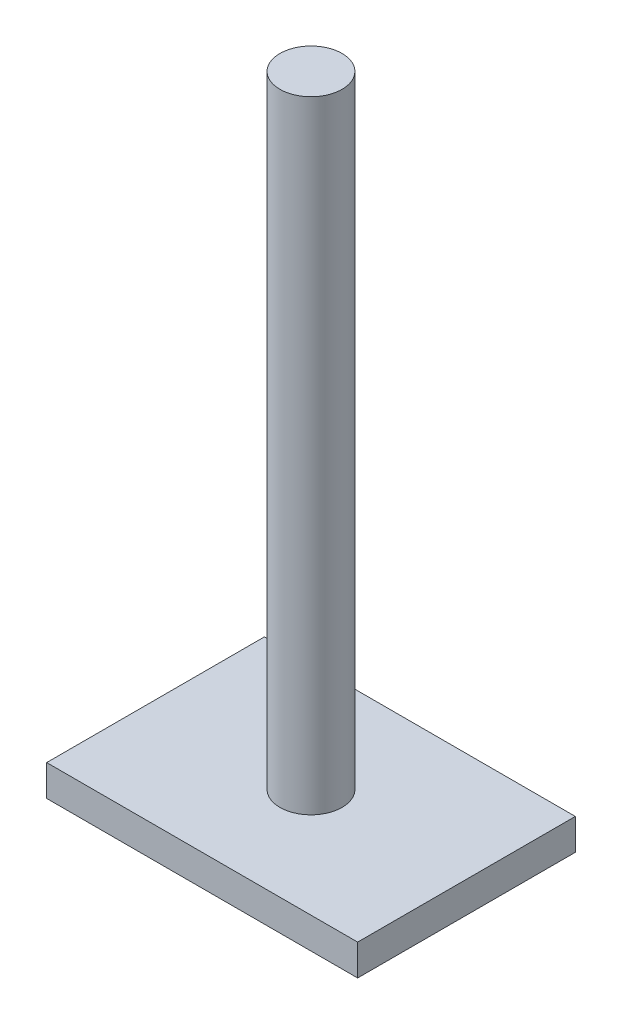
from build123d import *

# Parameters (mm, degrees)
SKETCH1_W           = 5
SKETCH1_H           = 3.5
BOSS_EXTRUDE1_DEPTH = 0.5
SKETCH2_R           = 0.499746314
BOSS_EXTRUDE2_DEPTH = 10


with BuildPart() as part:
    # Sketch1 → Boss-Extrude1 (new body)
    with BuildSketch(Plane(origin=(0, 0, 0), x_dir=(1, 0, 0), z_dir=(0, 1, 0))):
        Rectangle(SKETCH1_W, SKETCH1_H)
    extrude(amount=BOSS_EXTRUDE1_DEPTH)

    # Sketch2 → Boss-Extrude2 (add)
    with BuildSketch(Plane(origin=(0, 0.5, 0), x_dir=(1, 0, 0), z_dir=(0, 1, 0))):
        with Locations(Location((0, 0, 0), (0, 0, 270))):
            Circle(SKETCH2_R)
    extrude(amount=BOSS_EXTRUDE2_DEPTH)


solid = part.part
